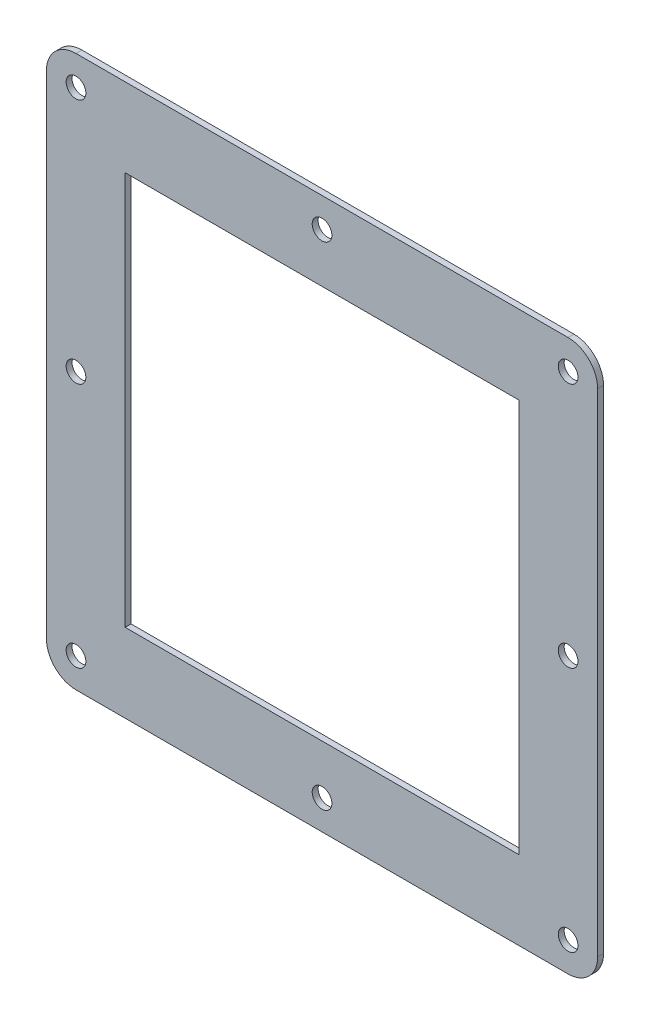
from build123d import *

# Parameters (mm, degrees)
SKETCH2_R           = 5
SKETCH2_R_2         = 4
BOSS_EXTRUDE1_DEPTH = 3
SKETCH3_W           = 200
SKETCH3_H           = 200
CUT_EXTRUDE1_DEPTH  = 10


with BuildPart() as part:
    # Sketch2 → Boss-Extrude1 (new body)
    with BuildSketch(Plane.XY):
        with BuildLine():
            Line((-125, 140), (125, 140))
            ThreePointArc((125, 140), (135.606601718, 135.606601718), (140, 125))
            Line((140, 125), (140, -125))
            ThreePointArc((140, -125), (135.606601718, -135.606601718), (125, -140))
            Line((125, -140), (-125, -140))
            ThreePointArc((-125, -140), (-135.606601718, -135.606601718), (-140, -125))
            Line((-140, -125), (-140, 125))
            ThreePointArc((-140, 125), (-135.606601718, 135.606601718), (-125, 140))
        make_face()
        with Locations((-125, 125)):
            Circle(SKETCH2_R, mode=Mode.SUBTRACT)
        with Locations((0, 125)):
            Circle(SKETCH2_R, mode=Mode.SUBTRACT)
        with Locations((125, 125)):
            Circle(SKETCH2_R, mode=Mode.SUBTRACT)
        Circle(SKETCH2_R_2, mode=Mode.SUBTRACT)
        with Locations((125, 0)):
            Circle(SKETCH2_R, mode=Mode.SUBTRACT)
        with Locations((-125, 0)):
            Circle(SKETCH2_R, mode=Mode.SUBTRACT)
        with Locations((-125, -125)):
            Circle(SKETCH2_R, mode=Mode.SUBTRACT)
        with Locations((0, -125)):
            Circle(SKETCH2_R, mode=Mode.SUBTRACT)
        with Locations((125, -125)):
            Circle(SKETCH2_R, mode=Mode.SUBTRACT)
    extrude(amount=BOSS_EXTRUDE1_DEPTH)

    # Sketch3 → Cut-Extrude1 (cut)
    with BuildSketch(Plane.XY.offset(3)):
        Rectangle(SKETCH3_W, SKETCH3_H)
    extrude(amount=-CUT_EXTRUDE1_DEPTH, mode=Mode.SUBTRACT)


solid = part.part
